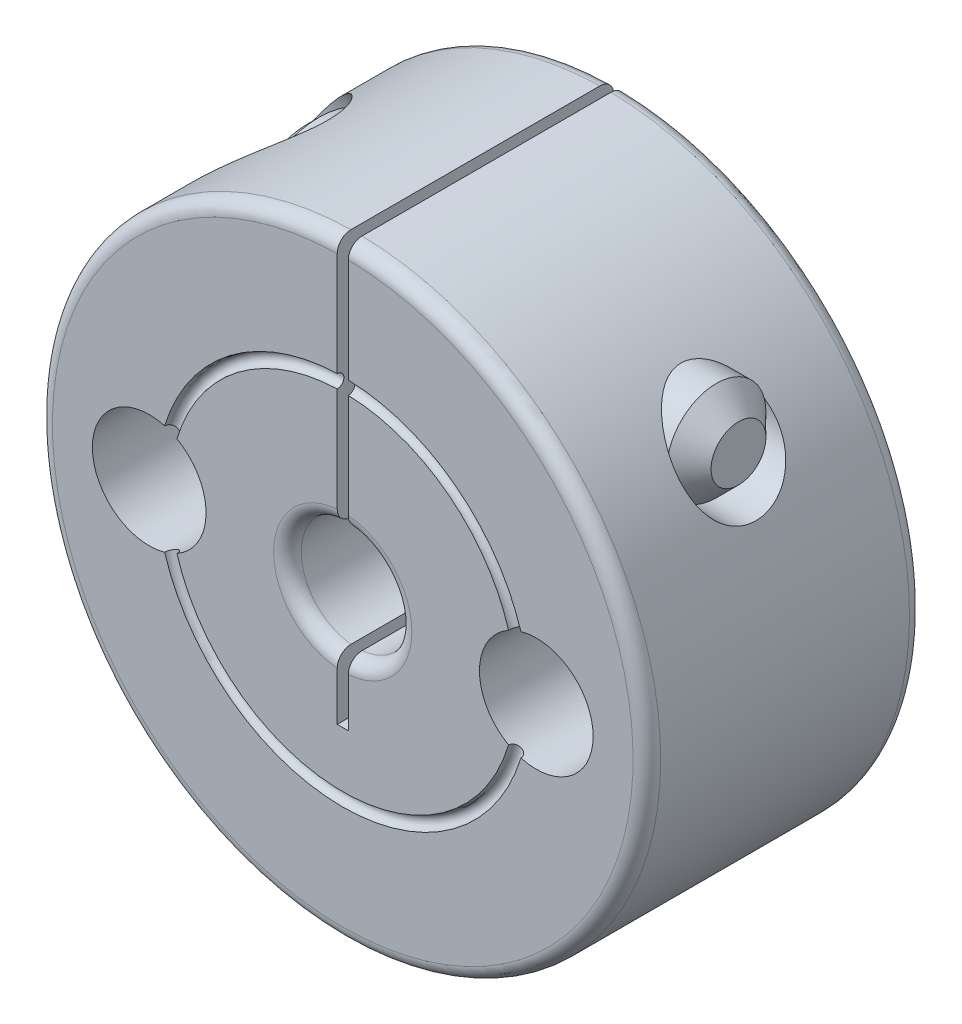
from build123d import *

# Parameters (mm, degrees)
EXTRUDE1_DEPTH                 = 3.96875
FILLET1_R                      = 0.396875
CUT_EXTRUDE1_DEPTH             = 2.38125
CHAMFER1_SIZE                  = 0.3175
CHAMFER2_SIZE                  = 0.635
SKETCH10_W                     = 1.63195
SKETCH10_H                     = 7.9375
F_4_CLEARANCE_HOLE2_AT_2_COUNT = 2
F_4_CLEARANCE_HOLE2_AT_2_PITCH = 11.1125


with BuildPart() as part:
    # Sketch1 → Extrude1 (new, symmetric)
    with BuildSketch(Plane.XY):
        with BuildLine():
            Line((-0.15875, 1.579542556), (-0.15875, 8.729806699))
            ThreePointArc((-0.15875, 8.729806699), (0, -8.73125), (0.15875, 8.729806699))
            Line((0.15875, 8.729806699), (0.15875, 1.579542556))
            ThreePointArc((0.15875, 1.579542556), (1.5875, 0), (0.15875, -1.579542556))
            Line((0.15875, -1.579542556), (0.15875, -3.3734375))
            Line((0.15875, -3.3734375), (-0.15875, -3.3734375))
            Line((-0.15875, -3.3734375), (-0.15875, -1.579542556))
            ThreePointArc((-0.15875, -1.579542556), (-1.5875, 0), (-0.15875, 1.579542556))
        make_face()
    extrude(amount=EXTRUDE1_DEPTH, both=True)

    # Fillet1
    fillet1_edges = [part.edges().sort_by_distance(p)[0] for p in [
        (0, -8.73125, -3.96875),
        (0, -8.73125, 3.96875),
        (-1.5875, 0, 3.96875),
        (-1.5875, 0, -3.96875),
        (1.5875, 0, 3.96875),
        (1.5875, 0, -3.96875),
    ]]
    fillet(fillet1_edges, radius=FILLET1_R)

    # Sketch2 → Cut-Revolve1 (revolve, cut)
    with BuildSketch(Plane(origin=(0, 0, 0), x_dir=(1, 0, 0), z_dir=(0, 1, 0))):
        with BuildLine():
            Line((-5.349875, -3.96875), (-4.968875, -3.96875))
            ThreePointArc((-4.968875, -3.96875), (-5.159375, -3.77825), (-5.349875, -3.96875))
        make_face()
    revolve(axis=Axis((0, 0, -3.96875), (0, 0, 1)), mode=Mode.SUBTRACT)

    # Sketch3 → Cut-Revolve2 (revolve, cut)
    with BuildSketch(Plane.XY):
        Polygon((8.73125, 5.154674628), (-8.73125, 5.154674628), (-8.73125, 2.767074628), (-2.1336, 2.767074628), (-2.1336, 3.732274628), (8.73125, 3.732274628), align=None)
    revolve(axis=Axis((-8.73125, 5.154674628, 0), (-1, 0, 0)), mode=Mode.SUBTRACT)

    # Sketch10 → #4 Clearance Hole2 (revolve, cut)
    with BuildSketch(Plane(origin=(-5.55625, 0, -3.96875), x_dir=(0, 1, 0), z_dir=(1, 0, 0))):
        with Locations((0.815975, 3.96875)):
            Rectangle(SKETCH10_W, SKETCH10_H)
    f_4_clearance_hole2 = revolve(axis=Axis((-5.55625, 0, -10.31875), (0, 0, 1)), mode=Mode.SUBTRACT)

    # #4 Clearance Hole2 at 2: #4 Clearance Hole2 ×2
    with Locations(*[(i * F_4_CLEARANCE_HOLE2_AT_2_PITCH, 0, 0) for i in range(1, F_4_CLEARANCE_HOLE2_AT_2_COUNT)]):
        add(f_4_clearance_hole2, mode=Mode.SUBTRACT)


with BuildPart() as body_2:
    # Sketch4 → Revolve1 (revolve)
    with BuildSketch(Plane.XY):
        Polygon((-4.9784, 5.154674628), (-4.9784, 7.478774628), (-2.1336, 7.478774628), (-2.1336, 6.577074628), (7.3914, 6.577074628), (7.3914, 5.154674628), align=None)
    revolve(axis=Axis((7.3914, 5.154674628, 0), (-1, 0, 0)))

    # Sketch5 → Cut-Extrude1 (cut)
    with BuildSketch(Plane(origin=(-4.9784, 0, 0), x_dir=(0, -1, 0), z_dir=(-1, 0, 0))):
        Polygon((-4.467266963, -1.190625), (-3.779859299, 0), (-4.467266963, 1.190625), (-5.842082292, 1.190625), (-6.529489956, 0), (-5.842082292, -1.190625), align=None)
    extrude(amount=-CUT_EXTRUDE1_DEPTH, mode=Mode.SUBTRACT)

    # Chamfer1
    chamfer1_edges = [body_2.edges().sort_by_distance(p)[0] for p in [
        (-4.9784, 2.830574628, 0),
    ]]
    chamfer(chamfer1_edges, length=CHAMFER1_SIZE)

    # Chamfer2
    chamfer2_edges = [body_2.edges().sort_by_distance(p)[0] for p in [
        (7.3914, 3.732274628, 0),
    ]]
    chamfer(chamfer2_edges, length=CHAMFER2_SIZE)


solid = Compound([part.part, body_2.part])
